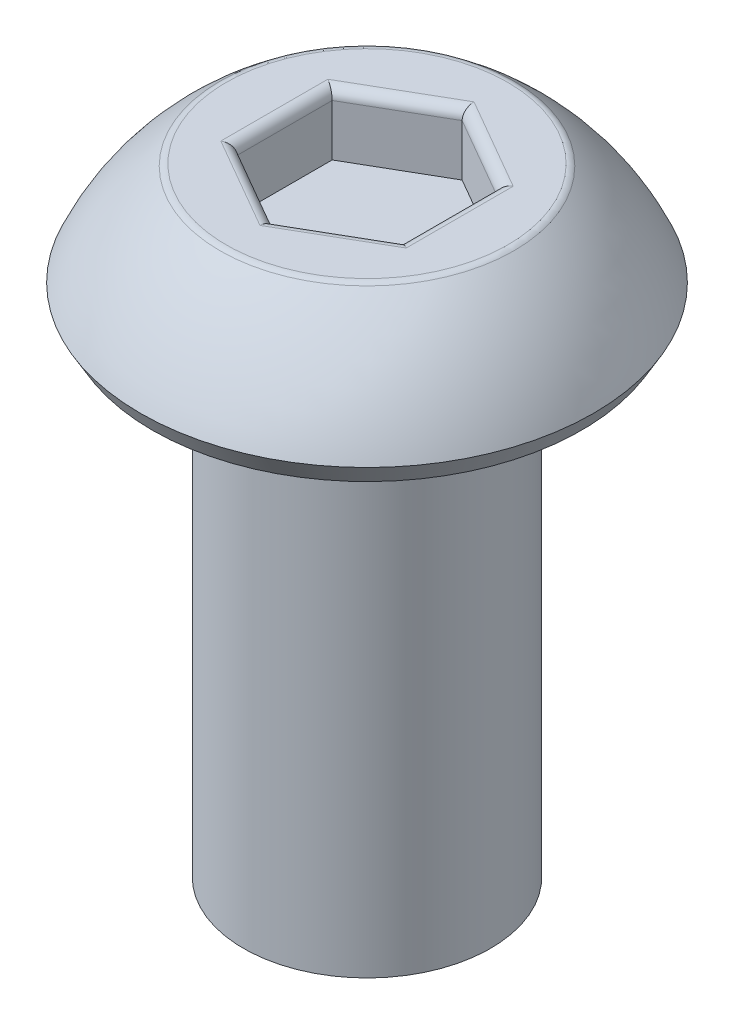
from build123d import *

# Parameters (mm, degrees)
CUT_EXTRUDE1_DEPTH = 0.75
FILLET1_R          = 0.125


with BuildPart() as part:
    # Sketch1 → Revolve1 (revolve)
    with BuildSketch(Plane(origin=(0, 0, 0), x_dir=(0, 0, -1), z_dir=(1, 0, 0)), mode=Mode.PRIVATE) as revolve1_sk:
        with BuildLine():
            Line((0, 1.5), (-1.75, 1.5))
            ThreePointArc((-1.75, 1.5), (-2.334912942, 0.942930354), (-2.75, 0.25))
            Line((-2.75, 0.25), (-2.605662433, 0))
            Line((-2.605662433, 0), (-1.5, 0))
            Line((-1.5, 0), (-1.5, -6))
            Line((-1.5, -6), (0, -6))
            Line((0, -6), (0, 1.5))
        make_face()
    revolve(revolve1_sk.sketch.rotate(Axis((0, -6, 0), (0, 1, 0)), 180), axis=Axis((0, -6, 0), (0, 1, 0)))

    # Sketch2 → Cut-Extrude1 (cut)
    with BuildSketch(Plane(origin=(0, 1.5, 0), x_dir=(1, 0, 0), z_dir=(0, 1, 0))):
        Polygon((0, 1.154700538), (-1, 0.577350269), (-1, -0.577350269), (0, -1.154700538), (1, -0.577350269), (1, 0.577350269), align=None)
    extrude(amount=-CUT_EXTRUDE1_DEPTH, mode=Mode.SUBTRACT)

    # Fillet1
    fillet1_edges = [part.edges().sort_by_distance(p)[0] for p in [
        (0.5, 1.5, -0.866025404),
        (-0.5, 1.5, -0.866025404),
        (-1, 1.5, 0),
        (-0.5, 1.5, 0.866025404),
        (0.5, 1.5, 0.866025404),
        (1, 1.5, 0),
        (0, 1.5, 1.75),
    ]]
    fillet(fillet1_edges, radius=FILLET1_R)


solid = part.part
